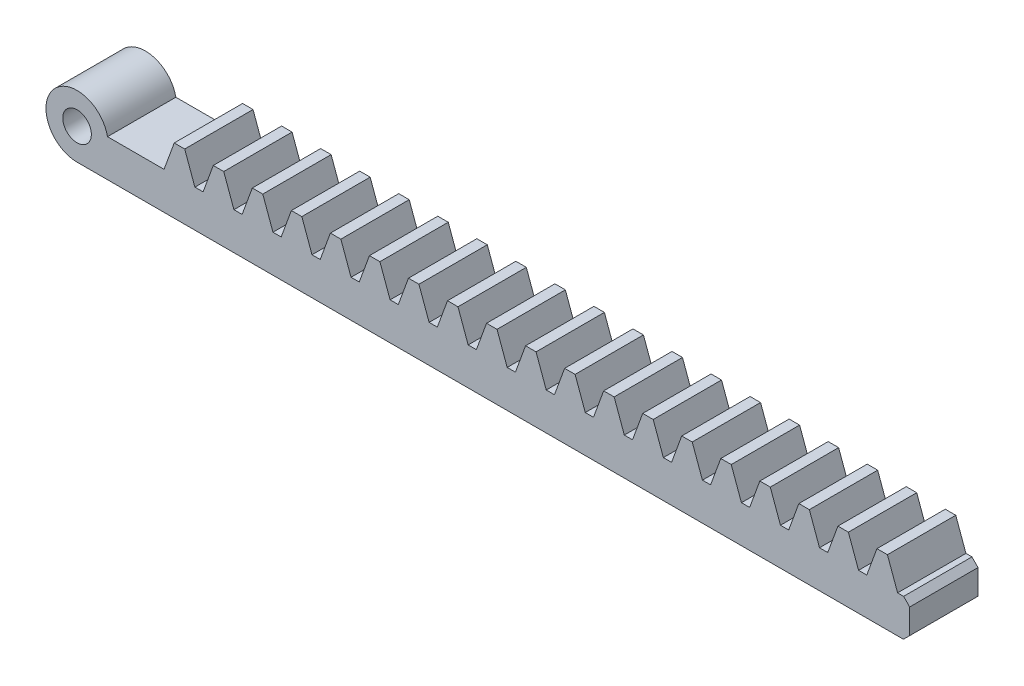
from build123d import *

# Parameters (mm, degrees)
SKETCH_1_W             = 60
SKETCH_1_H             = 3
EXTRUDE_1_DEPTH        = 5.5
EXTRUDE_2_DEPTH        = 5.5
PATTERN_LINEAR_1_COUNT = 19
PATTERN_LINEAR_1_PITCH = 3.141592654
SKETCH_3_R             = 1.15
EXTRUDE_1_2_DEPTH      = 5.5
CUT_EXTRUDE_2_DEPTH    = 6


with BuildPart() as part:
    # 草图1 → Extrude 1 (new body)
    with BuildSketch(Plane.XY):
        with Locations((30, -1.5)):
            Rectangle(SKETCH_1_W, SKETCH_1_H)
    extrude(amount=EXTRUDE_1_DEPTH)

    # 草图2 → 拉伸2 (add)
    with BuildSketch(Plane.XY.offset(5.5)):
        Polygon((0, 0), (0.818933027, 2.25), (1.661788885, 2.25), (2.480721912, 0), align=None)
    extrude_2 = extrude(amount=-EXTRUDE_2_DEPTH)

    # 阵列(线性)1: 拉伸2 ×19
    with Locations(*[(i * PATTERN_LINEAR_1_PITCH, 0, 0) for i in range(1, PATTERN_LINEAR_1_COUNT)]):
        add(extrude_2)

    # 草图3 → Extrude 1 2 (add)
    with BuildSketch(Plane(origin=(0, 0, 0), x_dir=(-1, 0, 0), z_dir=(0, 0, -1))):
        with BuildLine():
            Line((7, -3), (0, -3))
            Line((0, -3), (0, 0))
            Line((0, 0), (4.550510054, 0))
            ThreePointArc((4.550510054, 0), (8.93649166, 1.081138846), (7, -3))
        make_face()
        with Locations((7, -0.5)):
            Circle(SKETCH_3_R, mode=Mode.SUBTRACT)
    extrude(amount=-EXTRUDE_1_2_DEPTH)

    # 草图5 → 切除-拉伸2 (cut)
    with BuildSketch(Plane(origin=(0, 0, 0), x_dir=(-1, 0, 0), z_dir=(0, 0, -1))):
        Polygon((-59.514694839, 0), (-60, -0.5), (-60, 0), align=None)
        Polygon((-60, -3), (-60, -2.5), (-59.5, -3), align=None)
    extrude(amount=-CUT_EXTRUDE_2_DEPTH, mode=Mode.SUBTRACT)


solid = part.part
